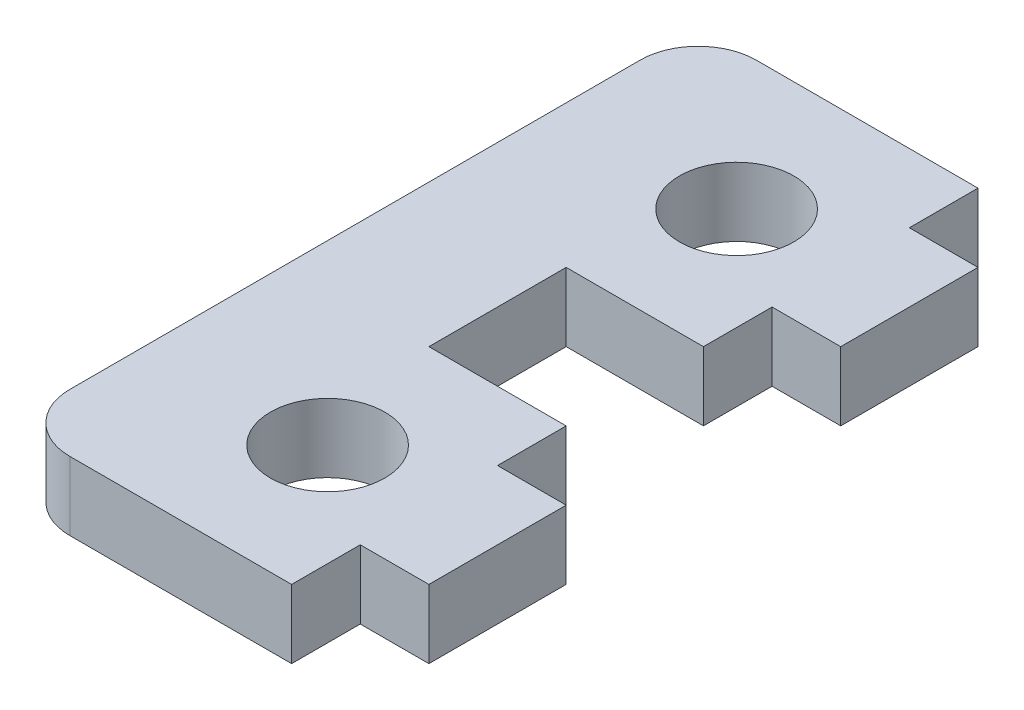
from build123d import *

# Parameters (mm, degrees)
SKETCH1_R           = 5
BOSS_EXTRUDE1_DEPTH = 6


with BuildPart() as part:
    # Sketch1 → Boss-Extrude1 (new body)
    with BuildSketch(Plane(origin=(0, 0, 0), x_dir=(1, 0, 0), z_dir=(0, 1, 0))):
        with BuildLine():
            Line((-21.126722314, 18.92), (-21.126722314, -30.92))
            ThreePointArc((-21.126722314, -30.92), (-19.638824763, -34.512102448), (-16.046722314, -36))
            Line((-16.046722314, -36), (3.332223015, -36))
            Line((3.332223015, -36), (3.332223015, -30))
            Line((3.332223015, -30), (9.332223015, -30))
            Line((9.332223015, -30), (9.332223015, -18))
            Line((9.332223015, -18), (3.332223015, -18))
            Line((3.332223015, -18), (3.332223015, -12))
            Line((3.332223015, -12), (-8.667776985, -12))
            Line((-8.667776985, -12), (-8.667776985, 0))
            Line((-8.667776985, 0), (3.332223015, 0))
            Line((3.332223015, 0), (3.332223015, 6))
            Line((3.332223015, 6), (9.332223015, 6))
            Line((9.332223015, 6), (9.332223015, 18))
            Line((9.332223015, 18), (3.332223015, 18))
            Line((3.332223015, 18), (3.332223015, 24))
            Line((3.332223015, 24), (-16.046722314, 24))
            ThreePointArc((-16.046722314, 24), (-19.638824763, 22.512102448), (-21.126722314, 18.92))
        make_face()
        with Locations(Location((-5.643722664, 11.877299035, 0), (0, 0, 270))):
            Circle(SKETCH1_R, mode=Mode.SUBTRACT)
        with Locations(Location((-5.643722664, -23.877299035, 0), (0, 0, 270))):
            Circle(SKETCH1_R, mode=Mode.SUBTRACT)
    extrude(amount=BOSS_EXTRUDE1_DEPTH)


solid = part.part
